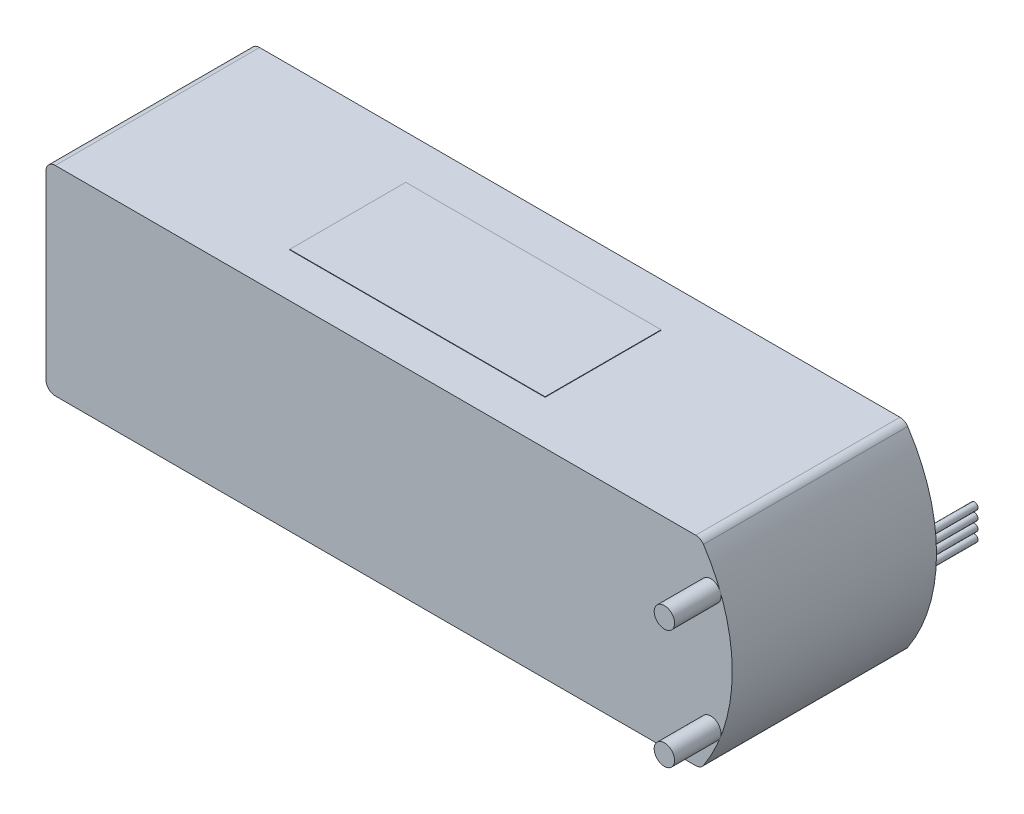
from build123d import *

# Parameters (mm, degrees)
EXTRUDE_1_DEPTH   = 22
SKETCH_2_R        = 2.2
EXTRUDE_2_DEPTH   = 10
EXTRUDE_2_2_DEPTH = 10
SKETCH_3_R        = 0.75
EXTRUDE_3_DEPTH   = 10
EXTRUDE_3_2_DEPTH = 10
EXTRUDE_3_3_DEPTH = 10
EXTRUDE_3_4_DEPTH = 10
SKETCH_5_W        = 55
SKETCH_5_H        = 25
EXTRUDE_4_DEPTH   = 0.1
FILLET_1_R        = 2


with BuildPart() as part:
    # 草图1 → 凸台-拉伸1 (new, symmetric)
    with BuildSketch(Plane.XY):
        with BuildLine():
            Line((-70.5, 21.5), (70.5, 21.5))
            ThreePointArc((70.5, 21.5), (77.316216314, 0), (70.5, -21.5))
            Line((70.5, -21.5), (-70.5, -21.5))
            Line((-70.5, -21.5), (-70.5, 21.5))
        make_face()
    extrude(amount=EXTRUDE_1_DEPTH, both=True)

    # 草图5 → 凸台-拉伸4 (add)
    with BuildSketch(Plane(origin=(0, 21.5, 0), x_dir=(1, 0, 0), z_dir=(0, 1, 0))):
        Rectangle(SKETCH_5_W, SKETCH_5_H)
    extrude(amount=EXTRUDE_4_DEPTH)

    # 圆角1
    fillet_1_edges = [part.edges().sort_by_distance(p)[0] for p in [
        (70.5, -21.5, 0),
        (-70.5, -21.5, 0),
        (-70.5, 21.5, 0),
        (70.5, 21.5, 0),
    ]]
    fillet(fillet_1_edges, radius=FILLET_1_R)


with BuildPart() as body_2:
    # 草图2 → 凸台-拉伸2 (new body)
    with BuildSketch(Plane.XY.offset(22)):
        with Locations((72.7, 12.800728425)):
            Circle(SKETCH_2_R)
    extrude(amount=EXTRUDE_2_DEPTH)


with BuildPart() as body_3:
    # 草图2 → Extrude 2 2 (new body)
    with BuildSketch(Plane.XY.offset(22)):
        with Locations(Location((72.7, -12.800728425, 0), (0, 0, 180))):
            Circle(SKETCH_2_R)
    extrude(amount=EXTRUDE_2_2_DEPTH)


with BuildPart() as body_4:
    # 草图3 → 凸台-拉伸3 (new body)
    with BuildSketch(Plane(origin=(0, 0, -22), x_dir=(-1, 0, 0), z_dir=(0, 0, -1))):
        with Locations((-75.5, 3)):
            Circle(SKETCH_3_R)
    extrude(amount=EXTRUDE_3_DEPTH)


with BuildPart() as body_5:
    # 草图3 → Extrude 3 2 (new body)
    with BuildSketch(Plane(origin=(0, 0, -22), x_dir=(-1, 0, 0), z_dir=(0, 0, -1))):
        with Locations((-75.5, 1)):
            Circle(SKETCH_3_R)
    extrude(amount=EXTRUDE_3_2_DEPTH)


with BuildPart() as body_6:
    # 草图3 → Extrude 3 3 (new body)
    with BuildSketch(Plane(origin=(0, 0, -22), x_dir=(-1, 0, 0), z_dir=(0, 0, -1))):
        with Locations(Location((-75.5, -1, 0), (0, 0, 180))):
            Circle(SKETCH_3_R)
    extrude(amount=EXTRUDE_3_3_DEPTH)


with BuildPart() as body_7:
    # 草图3 → Extrude 3 4 (new body)
    with BuildSketch(Plane(origin=(0, 0, -22), x_dir=(-1, 0, 0), z_dir=(0, 0, -1))):
        with Locations(Location((-75.5, -3, 0), (0, 0, 180))):
            Circle(SKETCH_3_R)
    extrude(amount=EXTRUDE_3_4_DEPTH)


solid = Compound([part.part, body_2.part, body_3.part, body_4.part, body_5.part, body_6.part, body_7.part])
